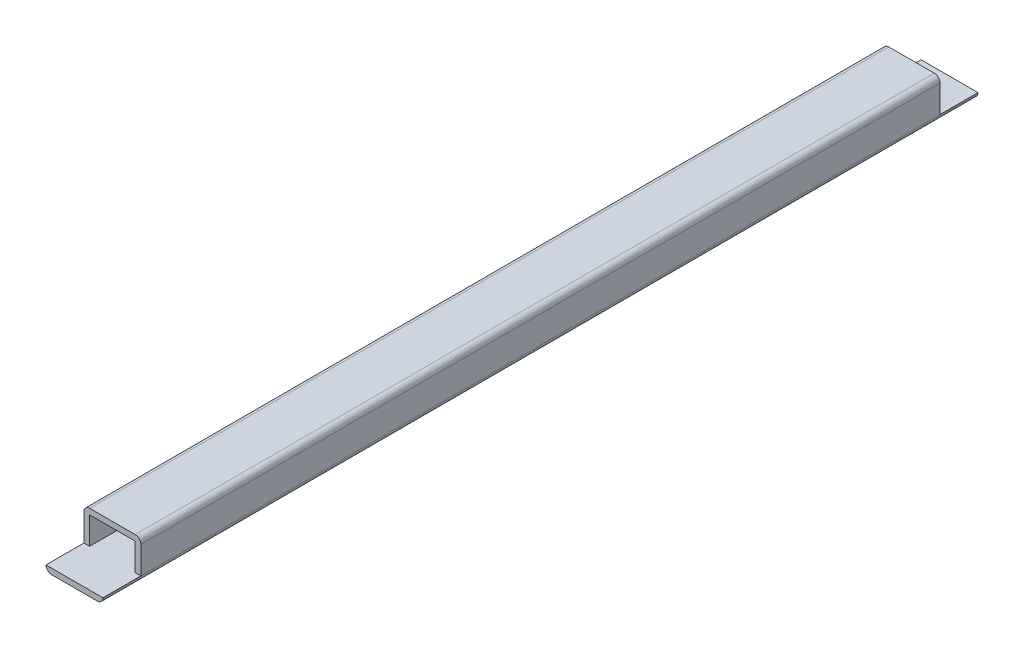
from build123d import *

# Parameters (mm, degrees)
SKETCH1_W           = 24
SKETCH1_H           = 14.34
BOSS_EXTRUDE1_DEPTH = 461
CUT_EXTRUDE1_START  = -20
CUT_EXTRUDE1_DEPTH  = 20
CUT_EXTRUDE2_DEPTH  = 20


with BuildPart() as part:
    # Sketch1 → Boss-Extrude1 (new body)
    with BuildSketch(Plane.XY):
        with BuildLine():
            Line((3, 0), (27, 0))
            ThreePointArc((27, 0), (29.121320344, 0.878679656), (30, 3))
            Line((30, 3), (30, 17.34))
            ThreePointArc((30, 17.34), (29.121320344, 19.461320344), (27, 20.34))
            Line((27, 20.34), (3, 20.34))
            ThreePointArc((3, 20.34), (0.878679656, 19.461320344), (0, 17.34))
            Line((0, 17.34), (0, 3))
            ThreePointArc((0, 3), (0.878679656, 0.878679656), (3, 0))
        make_face()
        with Locations((15, 10.17)):
            Rectangle(SKETCH1_W, SKETCH1_H, mode=Mode.SUBTRACT)
    extrude(amount=BOSS_EXTRUDE1_DEPTH)

    # Sketch2 → Cut-Extrude1 (cut)
    with BuildSketch(Plane.XY.offset(461).offset(CUT_EXTRUDE1_START)):
        with BuildLine():
            Line((3, 3), (0, 3))
            Line((0, 3), (0, 17.34))
            ThreePointArc((0, 17.34), (0.878679656, 19.461320344), (3, 20.34))
            Line((3, 20.34), (27, 20.34))
            ThreePointArc((27, 20.34), (29.121320344, 19.461320344), (30, 17.34))
            Line((30, 17.34), (30, 3))
            Line((30, 3), (27, 3))
            Line((27, 3), (27, 17.34))
            Line((27, 17.34), (3, 17.34))
            Line((3, 17.34), (3, 3))
        make_face()
    extrude(amount=CUT_EXTRUDE1_DEPTH, mode=Mode.SUBTRACT)

    # Sketch3 → Cut-Extrude2 (cut)
    with BuildSketch(Plane(origin=(0, 0, 0), x_dir=(-1, 0, 0), z_dir=(0, 0, -1))):
        with BuildLine():
            Line((-27, 3), (-27, 17.34))
            Line((-27, 17.34), (-3, 17.34))
            Line((-3, 17.34), (-3, 3))
            Line((-3, 3), (0, 3))
            Line((0, 3), (0, 17.34))
            ThreePointArc((0, 17.34), (-0.878679656, 19.461320344), (-3, 20.34))
            Line((-3, 20.34), (-27, 20.34))
            ThreePointArc((-27, 20.34), (-29.121320344, 19.461320344), (-30, 17.34))
            Line((-30, 17.34), (-30, 3))
            Line((-30, 3), (-27, 3))
        make_face()
    extrude(amount=-CUT_EXTRUDE2_DEPTH, mode=Mode.SUBTRACT)


solid = part.part
